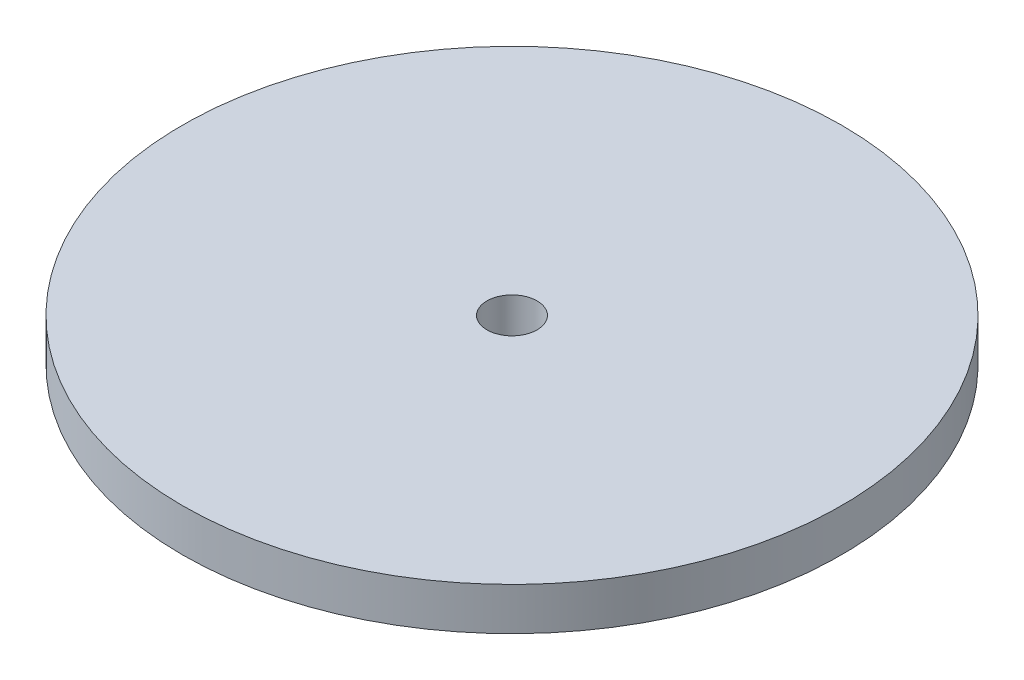
from build123d import *


with BuildPart() as part:
    # Sketch1 → Revolve1 (revolve)
    with BuildSketch(Plane.XY, mode=Mode.PRIVATE) as revolve1_sk:
        Polygon((2.794, 0), (2.794, 3.3782), (1.3462, 3.3782), (1.3462, 5.6642), (17.6657, 5.6642), (17.6657, 3.3782), (4.3815, 3.3782), (4.3815, 0), align=None)
    revolve(revolve1_sk.sketch.rotate(Axis((0, 0, 0), (0, 1, 0)), 90), axis=Axis((0, 0, 0), (0, 1, 0)))


solid = part.part
